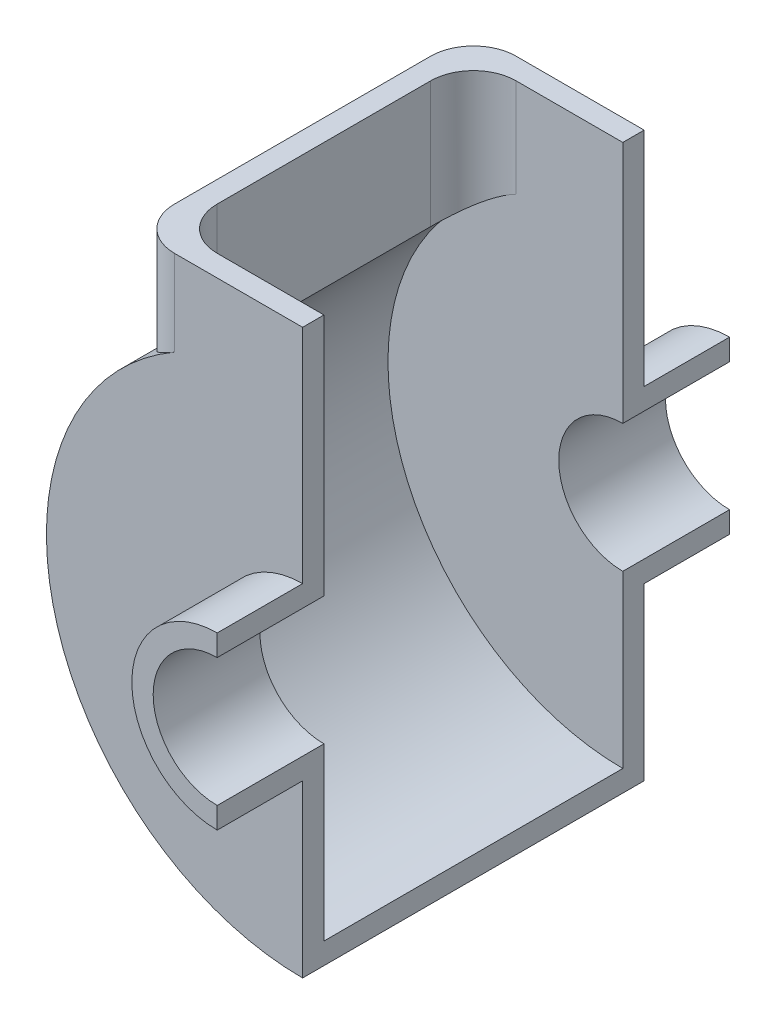
from build123d import *

# Parameters (mm, degrees)
DODANIE_WYCI_GNI_CIE2_DEPTH       = 5
DODANIE_WYCI_GNI_CIE3_DEPTH       = 25
WYCI_GNI_CIE_CIENKA_CIANKA4_REACH = 135.45
ZAOKR_GLENIE2_R                   = 10
ZAOKR_GLENIE3_R                   = 10
ZAOKR_GLENIE4_R                   = 10
ZAOKR_GLENIE5_R                   = 10


with BuildPart() as part:
    # Szkic1 → Dodanie-wyciągnięcie2 (new body)
    with BuildSketch(Plane.XY):
        with BuildLine():
            ThreePointArc((0, -20), (-20, 0), (0, 20))
            Line((0, 20), (0, 72))
            Line((0, 72), (-40, 72))
            Line((-40, 72), (-40, 44.72135955))
            ThreePointArc((-40, 44.72135955), (-56.050341538, -21.409325386), (0, -60))
            Line((0, -60), (0, -20))
        make_face()
    extrude(amount=DODANIE_WYCI_GNI_CIE2_DEPTH)

    # Szkic1<4> → Dodanie-wyciągnięcie3 (add)
    with BuildSketch(Plane.XY):
        with BuildLine():
            Line((0, 15), (0, 20))
            ThreePointArc((0, 20), (-20, 0), (0, -20))
            Line((0, -20), (0, -15))
            ThreePointArc((0, -15), (-15, 0), (0, 15))
        make_face()
    extrude(amount=DODANIE_WYCI_GNI_CIE3_DEPTH)


with BuildPart() as body_2:
    # Lustro7: mirrored copy
    add(part.part.mirror(Plane(origin=(0, 0, -35), x_dir=(1, 0, 0), z_dir=(0, 0, -1))))

    # Szkic8 → Wyciągnięcie-cienka ścianka4 (add, up to next)
    with BuildSketch(Plane.XY, mode=Mode.PRIVATE) as wyci_gni_cie_cienka_cianka4_sk1:
        with BuildLine():
            Line((-40, 72), (-40, 44.72135955))
            ThreePointArc((-40, 44.72135955), (-56.050341538, -21.409325386), (0, -60))
            Line((0, -60), (0, -55))
            ThreePointArc((0, -55), (-51.76124215, -18.594994247), (-35, 42.426406871))
            Line((-35, 42.426406871), (-35, 72))
            Line((-35, 72), (-40, 72))
        make_face()
    wyci_gni_cie_cienka_cianka4_tool1 = extrude(wyci_gni_cie_cienka_cianka4_sk1.sketch, amount=-WYCI_GNI_CIE_CIENKA_CIANKA4_REACH, mode=Mode.PRIVATE) - body_2.part

    add(part.part)  # Wyciągnięcie-cienka ścianka4 merges part
    add(wyci_gni_cie_cienka_cianka4_tool1.solids().sort_by_distance((-36.449966, 57.213203, 0))[0])

    # Zaokrąglenie2
    zaokr_glenie2_edges = [body_2.edges().sort_by_distance(p)[0] for p in [
        (-40, 58.360679775, -75),
    ]]
    fillet(zaokr_glenie2_edges, radius=ZAOKR_GLENIE2_R)

    # Zaokrąglenie3
    zaokr_glenie3_edges = [body_2.edges().sort_by_distance(p)[0] for p in [
        (-40, 58.360679775, 5),
    ]]
    fillet(zaokr_glenie3_edges, radius=ZAOKR_GLENIE3_R)

    # Zaokrąglenie4
    zaokr_glenie4_edges = [body_2.edges().sort_by_distance(p)[0] for p in [
        (-35, 57.213203436, 0),
    ]]
    fillet(zaokr_glenie4_edges, radius=ZAOKR_GLENIE4_R)

    # Zaokrąglenie5
    zaokr_glenie5_edges = [body_2.edges().sort_by_distance(p)[0] for p in [
        (-35, 57.213203436, -70),
    ]]
    fillet(zaokr_glenie5_edges, radius=ZAOKR_GLENIE5_R)


solid = body_2.part
